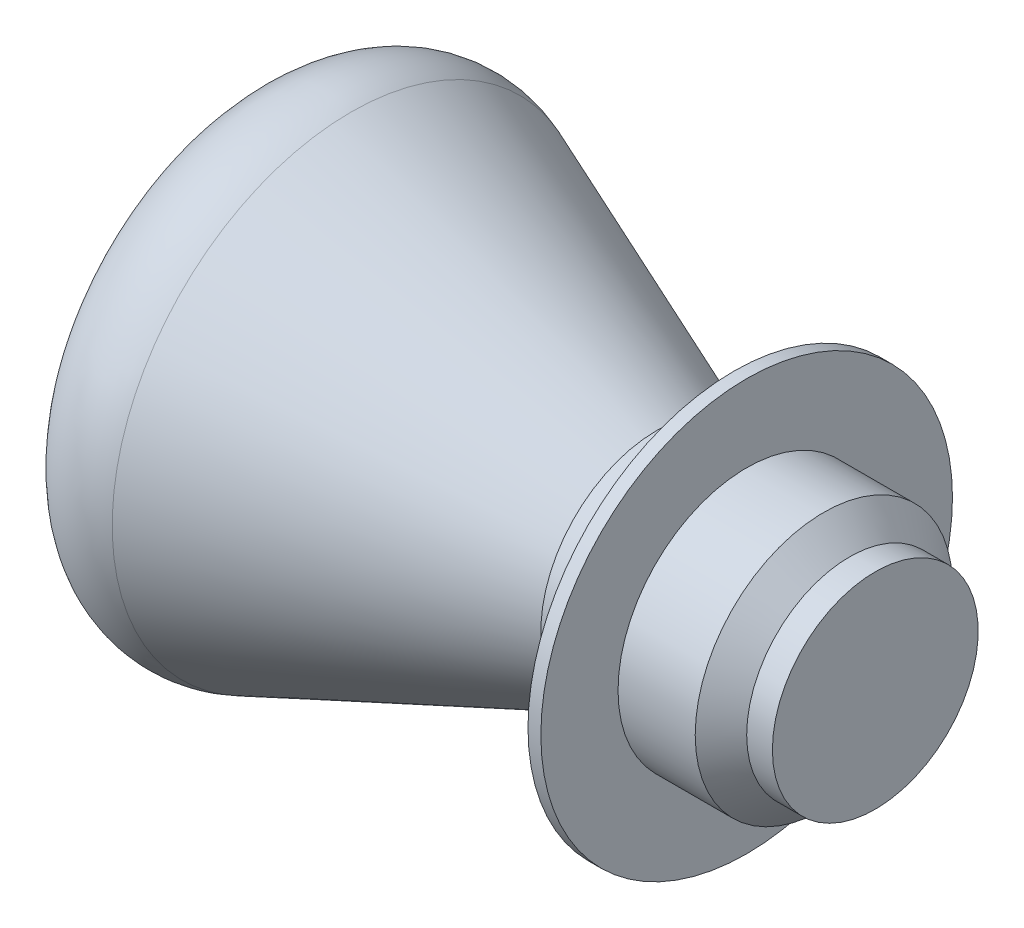
from build123d import *


with BuildPart() as part:
    # Sketch1 → Revolve1 (revolve)
    with BuildSketch(Plane.XY, mode=Mode.PRIVATE) as revolve1_sk:
        Polygon((0, 0), (5.5, 0), (5.5, 4), (4.5, 4), (3.5, 5), (0.5, 5), (0.5, 8), (0, 8), (0, 5), (-2, 5), (-2, 4.5), (0, 4.5), align=None)
    revolve(revolve1_sk.sketch.rotate(Axis((0, 0, 0), (1, 0, 0)), 90), axis=Axis((0, 0, 0), (1, 0, 0)))


with BuildPart() as body_2:
    # Sketch2 → Revolve2 (revolve)
    with BuildSketch(Plane.XY, mode=Mode.PRIVATE) as revolve2_sk:
        with BuildLine():
            Line((0, 0), (0, 4.5))
            Line((0, 4.5), (-3, 4.5))
            Line((-3, 4.5), (-14.879552076, 9.282911506))
            ThreePointArc((-14.879552076, 9.282911506), (-17.339156162, 9.184522448), (-18.897161062, 7.278753994))
            ThreePointArc((-18.897161062, 7.278753994), (-19.617023423, 3.670972882), (-19.858362338, 0))
            Line((-19.858362338, 0), (0, 0))
        make_face()
    revolve(revolve2_sk.sketch.rotate(Axis((-19.858362338, 0, 0), (1, 0, 0)), 180), axis=Axis((-19.858362338, 0, 0), (1, 0, 0)))


solid = Compound([part.part, body_2.part])
